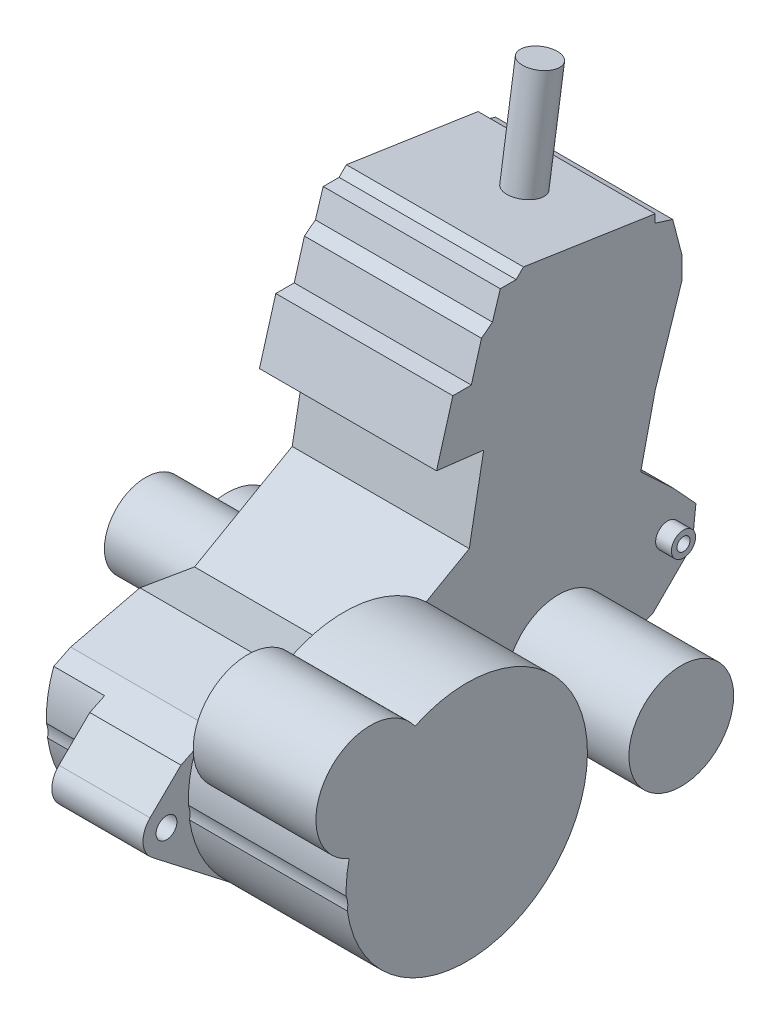
from build123d import *

# Parameters (mm, degrees)
SKETCH3_R           = 8.765690973
SKETCH3_R_2         = 7.546329472
BOSS_EXTRUDE1_DEPTH = 33.02
SKETCH3_3_R         = 8.765690973
SKETCH3_3_R_2       = 4.747089374
BOSS_EXTRUDE2_DEPTH = 69.85
BOSS_EXTRUDE3_START = 58.42
SKETCH3_4_R         = 8.765690973
BOSS_EXTRUDE3_DEPTH = 25.4
BOSS_EXTRUDE4_START = 147.32
SKETCH3_5_R         = 37.933984784
BOSS_EXTRUDE4_DEPTH = 88.9
BOSS_EXTRUDE5_START = -33.02
SKETCH3_6_R         = 8.765690973
BOSS_EXTRUDE5_DEPTH = 36.83
SKETCH4_R           = 29.883477217
SKETCH4_R_2         = 43.238390789
BOSS_EXTRUDE6_DEPTH = 63.5
SKETCH5_R           = 12.7
BOSS_EXTRUDE7_DEPTH = 76.2


with BuildPart() as part:
    # Sketch3 → Boss-Extrude1 (new, symmetric)
    with BuildSketch(Plane(origin=(0, 0, 0), x_dir=(0, 0, -1), z_dir=(1, 0, 0))):
        with BuildLine():
            Line((26.855598623, 34.04153134), (4.47810231, 12.180709193))
            ThreePointArc((4.47810231, 12.180709193), (-0.623125102, -0.971268934), (5.942795811, -13.456689726))
            Line((5.942795811, -13.456689726), (66.019432644, -60.042158643))
            ThreePointArc((66.019432644, -60.042158643), (76.890934177, -67.24165573), (88.712417559, -72.743912948))
            Line((88.712417559, -72.743912948), (111.45096516, -102.748262935))
            Line((111.45096516, -102.748262935), (144.477083252, -102.748262935))
            Line((144.477083252, -102.748262935), (169.002654574, -78.222691613))
            Line((169.002654574, -78.222691613), (195.607463956, -67.881296304))
            Line((195.607463956, -67.881296304), (230.151439421, -67.881296304))
            Line((230.151439421, -67.881296304), (255.413307952, -58.06190745))
            Line((255.413307952, -58.06190745), (278.88283078, -45.976265865))
            ThreePointArc((278.88283078, -45.976265865), (294.32962444, -40.865539072), (306.21453812, -29.753753007))
            Line((306.21453812, -29.753753007), (343.20837466, -16.328313428))
            Line((343.20837466, -16.328313428), (371.754392863, 12.180709193))
            Line((371.754392863, 12.180709193), (374.485546232, 37.116975937))
            Line((374.485546232, 37.116975937), (357.663762198, 55.324665065))
            Line((357.663762198, 55.324665065), (334.531136252, 76.90543329))
            Line((334.531136252, 76.90543329), (344.934785387, 122.683933603))
            Line((344.934785387, 122.683933603), (364.263564291, 181.676846378))
            Line((364.263564291, 181.676846378), (364.263564291, 198.452389962))
            Line((364.263564291, 198.452389962), (357.663762198, 223.699422208))
            Line((357.663762198, 223.699422208), (344.934785387, 227.677887566))
            Line((344.934785387, 227.677887566), (344.934785387, 233.598698071))
            Line((344.934785387, 233.598698071), (249.548191735, 247.947506817))
            Line((249.548191735, 247.947506817), (244.248903474, 242.648218557))
            Line((244.248903474, 242.648218557), (232.751756038, 242.648218557))
            Line((232.751756038, 242.648218557), (227.094867147, 224.549177586))
            Line((227.094867147, 224.549177586), (219.151380314, 218.377908492))
            Line((219.151380314, 218.377908492), (211.768889899, 192.707825641))
            Line((211.768889899, 192.707825641), (198.41781103, 192.707825641))
            Line((198.41781103, 192.707825641), (186.570468216, 151.512747216))
            Line((186.570468216, 151.512747216), (220.727605993, 147.448698974))
            Line((220.727605993, 147.448698974), (210.286236359, 90.83239142))
            Line((210.286236359, 90.83239142), (139.553233817, 50.621163948))
            Line((139.553233817, 50.621163948), (99.972286673, 57.295598172))
            Line((99.972286673, 57.295598172), (49.830851017, 45.21297855))
            Line((49.830851017, 45.21297855), (26.855598623, 34.04153134))
        make_face()
        with Locations((354.042271494, 27.57532186)):
            Circle(SKETCH3_R, mode=Mode.SUBTRACT)
        with Locations((16.377571024, 0)):
            Circle(SKETCH3_R_2, mode=Mode.SUBTRACT)
    extrude(amount=BOSS_EXTRUDE1_DEPTH, both=True)



with BuildPart() as body_2:
    # Sketch3<3> → Boss-Extrude2 (new, symmetric)
    with BuildSketch(Plane(origin=(0, 0, 0), x_dir=(0, 0, -1), z_dir=(1, 0, 0))):
        with Locations((354.042271494, 27.57532186)):
            Circle(SKETCH3_3_R)
        with Locations((354.042271494, 27.57532186)):
            Circle(SKETCH3_3_R_2, mode=Mode.SUBTRACT)
    extrude(amount=BOSS_EXTRUDE2_DEPTH, both=True)


with BuildPart() as part_1:
    add(part.part)

    add(body_2.part)  # Boss-Extrude3 merges body 2
    # Sketch3<4> → Boss-Extrude3 (add)
    with BuildSketch(Plane(origin=(0, 0, 0), x_dir=(0, 0, -1), z_dir=(1, 0, 0)).offset(BOSS_EXTRUDE3_START)):
        with BuildLine():
            ThreePointArc((32.215659867, 6.254756105), (33.341085724, 1.485328635), (33.061654594, -3.407108386))
            ThreePointArc((33.061654594, -3.407108386), (51.413629646, -45.679009257), (88.712417559, -72.743912948))
            Line((88.712417559, -72.743912948), (111.45096516, -102.748262935))
            Line((111.45096516, -102.748262935), (144.477083252, -102.748262935))
            Line((144.477083252, -102.748262935), (169.002654574, -78.222691613))
            Line((169.002654574, -78.222691613), (195.607463956, -67.881296304))
            Line((195.607463956, -67.881296304), (230.151439421, -67.881296304))
            Line((230.151439421, -67.881296304), (255.413307952, -58.06190745))
            Line((255.413307952, -58.06190745), (278.88283078, -45.976265865))
            ThreePointArc((278.88283078, -45.976265865), (294.32962444, -40.865539072), (306.21453812, -29.753753007))
            Line((306.21453812, -29.753753007), (343.20837466, -16.328313428))
            Line((343.20837466, -16.328313428), (371.754392863, 12.180709193))
            Line((371.754392863, 12.180709193), (374.485546232, 37.116975937))
            Line((374.485546232, 37.116975937), (357.663762198, 55.324665065))
            Line((357.663762198, 55.324665065), (334.531136252, 76.90543329))
            Line((334.531136252, 76.90543329), (344.934785387, 122.683933603))
            Line((344.934785387, 122.683933603), (364.263564291, 181.676846378))
            Line((364.263564291, 181.676846378), (364.263564291, 198.452389962))
            Line((364.263564291, 198.452389962), (357.663762198, 223.699422208))
            Line((357.663762198, 223.699422208), (344.934785387, 227.677887566))
            Line((344.934785387, 227.677887566), (344.934785387, 233.598698071))
            Line((344.934785387, 233.598698071), (249.548191735, 247.947506817))
            Line((249.548191735, 247.947506817), (244.248903474, 242.648218557))
            Line((244.248903474, 242.648218557), (232.751756038, 242.648218557))
            Line((232.751756038, 242.648218557), (227.094867147, 224.549177586))
            Line((227.094867147, 224.549177586), (219.151380314, 218.377908492))
            Line((219.151380314, 218.377908492), (211.768889899, 192.707825641))
            Line((211.768889899, 192.707825641), (198.41781103, 192.707825641))
            Line((198.41781103, 192.707825641), (186.570468216, 151.512747216))
            Line((186.570468216, 151.512747216), (220.727605993, 147.448698974))
            Line((220.727605993, 147.448698974), (210.286236359, 90.83239142))
            Line((210.286236359, 90.83239142), (139.553233817, 50.621163948))
            Line((139.553233817, 50.621163948), (99.972286673, 57.295598172))
            Line((99.972286673, 57.295598172), (49.830851017, 45.21297855))
            Line((49.830851017, 45.21297855), (37.556768138, 39.2448496))
            ThreePointArc((37.556768138, 39.2448496), (33.294973494, 23.007425276), (32.215659867, 6.254756105))
        make_face()
        with Locations((354.042271494, 27.57532186)):
            Circle(SKETCH3_4_R, mode=Mode.SUBTRACT)
    extrude(amount=-BOSS_EXTRUDE3_DEPTH)

    # Sketch3<5> → Boss-Extrude4 (add)
    with BuildSketch(Plane(origin=(0, 0, 0), x_dir=(0, 0, -1), z_dir=(1, 0, 0)).offset(BOSS_EXTRUDE4_START)):
        with BuildLine():
            ThreePointArc((82.075918233, 87.994388044), (19.03494718, 89.912772519), (34.422828639, 28.74858909))
            ThreePointArc((34.422828639, 28.74858909), (32.589179891, 17.57330891), (32.215659867, 6.254756105))
            ThreePointArc((32.215659867, 6.254756105), (33.341085724, 1.485328635), (33.061654594, -3.407108386))
            ThreePointArc((33.061654594, -3.407108386), (196.622426511, -32.27419595), (82.075918233, 87.994388044))
        make_face()
        with Locations(Location((274.967874889, -8.24484233, 0), (0, 0, 275.923726861))):
            Circle(SKETCH3_5_R)
    extrude(amount=-BOSS_EXTRUDE4_DEPTH)

    # Sketch3<6> → Boss-Extrude5 (add)
    with BuildSketch(Plane(origin=(0, 0, 0), x_dir=(0, 0, -1), z_dir=(1, 0, 0)).offset(BOSS_EXTRUDE5_START)):
        with BuildLine():
            ThreePointArc((32.215659867, 6.254756105), (33.341085724, 1.485328635), (33.061654594, -3.407108386))
            ThreePointArc((33.061654594, -3.407108386), (51.413629646, -45.679009257), (88.712417559, -72.743912948))
            Line((88.712417559, -72.743912948), (111.45096516, -102.748262935))
            Line((111.45096516, -102.748262935), (144.477083252, -102.748262935))
            Line((144.477083252, -102.748262935), (169.002654574, -78.222691613))
            Line((169.002654574, -78.222691613), (195.607463956, -67.881296304))
            Line((195.607463956, -67.881296304), (230.151439421, -67.881296304))
            Line((230.151439421, -67.881296304), (255.413307952, -58.06190745))
            Line((255.413307952, -58.06190745), (278.88283078, -45.976265865))
            ThreePointArc((278.88283078, -45.976265865), (294.32962444, -40.865539072), (306.21453812, -29.753753007))
            Line((306.21453812, -29.753753007), (343.20837466, -16.328313428))
            Line((343.20837466, -16.328313428), (371.754392863, 12.180709193))
            Line((371.754392863, 12.180709193), (374.485546232, 37.116975937))
            Line((374.485546232, 37.116975937), (357.663762198, 55.324665065))
            Line((357.663762198, 55.324665065), (334.531136252, 76.90543329))
            Line((334.531136252, 76.90543329), (344.934785387, 122.683933603))
            Line((344.934785387, 122.683933603), (364.263564291, 181.676846378))
            Line((364.263564291, 181.676846378), (364.263564291, 198.452389962))
            Line((364.263564291, 198.452389962), (357.663762198, 223.699422208))
            Line((357.663762198, 223.699422208), (344.934785387, 227.677887566))
            Line((344.934785387, 227.677887566), (344.934785387, 233.598698071))
            Line((344.934785387, 233.598698071), (249.548191735, 247.947506817))
            Line((249.548191735, 247.947506817), (244.248903474, 242.648218557))
            Line((244.248903474, 242.648218557), (232.751756038, 242.648218557))
            Line((232.751756038, 242.648218557), (227.094867147, 224.549177586))
            Line((227.094867147, 224.549177586), (219.151380314, 218.377908492))
            Line((219.151380314, 218.377908492), (211.768889899, 192.707825641))
            Line((211.768889899, 192.707825641), (198.41781103, 192.707825641))
            Line((198.41781103, 192.707825641), (186.570468216, 151.512747216))
            Line((186.570468216, 151.512747216), (220.727605993, 147.448698974))
            Line((220.727605993, 147.448698974), (210.286236359, 90.83239142))
            Line((210.286236359, 90.83239142), (139.553233817, 50.621163948))
            Line((139.553233817, 50.621163948), (99.972286673, 57.295598172))
            Line((99.972286673, 57.295598172), (49.830851017, 45.21297855))
            Line((49.830851017, 45.21297855), (37.556768138, 39.2448496))
            ThreePointArc((37.556768138, 39.2448496), (33.294973494, 23.007425276), (32.215659867, 6.254756105))
        make_face()
        with Locations((354.042271494, 27.57532186)):
            Circle(SKETCH3_6_R, mode=Mode.SUBTRACT)
    extrude(amount=-BOSS_EXTRUDE5_DEPTH)

    # Sketch4 → Boss-Extrude6 (add)
    with BuildSketch(Plane.ZY.offset(69.85)):
        with Locations(Location((-167.668024488, 31.122707437, 0), (0, 0, 180))):
            Circle(SKETCH4_R)
        with Locations(Location((-226.332433107, -21.383558841, 0), (0, 0, 180))):
            Circle(SKETCH4_R_2)
    extrude(amount=BOSS_EXTRUDE6_DEPTH)

    # Sketch5 → Boss-Extrude7 (add)
    with BuildSketch(Plane(origin=(0, 279.169325886, -41.994866484), x_dir=(1, 0, 0), z_dir=(0, 0.9888741863075109, -0.1487543063398786))):
        with Locations(Location((0, 269.608209436, 0), (0, 0, 270))):
            Circle(SKETCH5_R)
    extrude(amount=BOSS_EXTRUDE7_DEPTH)


solid = part_1.part
